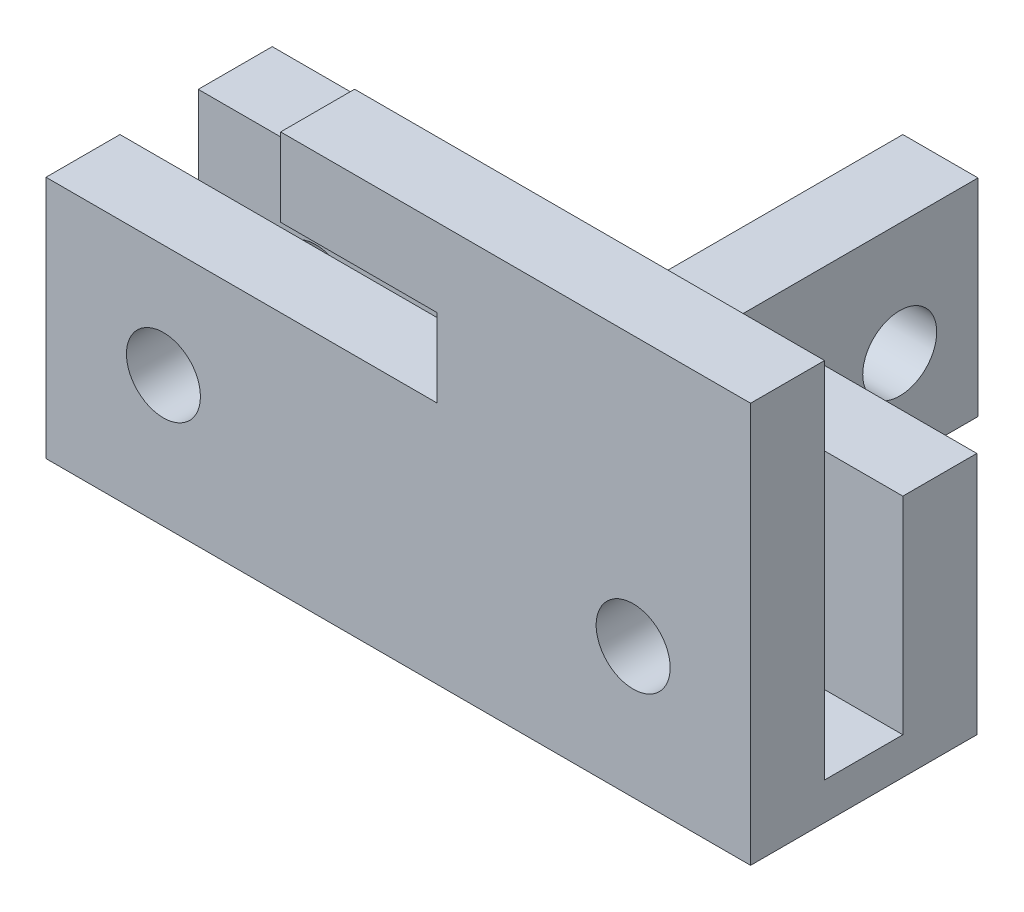
from build123d import *

# Parameters (mm, degrees)
BOSS_EXTRUDE1_DEPTH    = 14.2875
SKETCH4_R              = 1.5
CUT_EXTRUDE1_DEPTH     = 20.646048082
CUT_EXTRUDE3_REACH     = 21.646
SKETCH8_W              = 3.175
SKETCH8_H              = 8.382
SKETCH6_W              = 9.7
SKETCH6_H              = 8.382
SKETCH6_R              = 1.5
BOSS_EXTRUDE4_DEPTH    = 3.048
RIGHT_RAMP_MOUNT_DEPTH = 3


with BuildPart() as part:
    # Sketch2 → Boss-Extrude1 (new, symmetric)
    with BuildSketch(Plane(origin=(0, 0, 0), x_dir=(0, 0, -1), z_dir=(1, 0, 0))):
        Polygon((3, 1.5), (3, 9.882), (0, 9.882), (0, 0), (6.175, 0), (6.175, 1.5), align=None)
        Polygon((6.175, 1.5), (6.175, 0), (9.175, 0), (9.175, 9.882), (6.175, 9.882), align=None)
    extrude(amount=BOSS_EXTRUDE1_DEPTH, both=True)

    # Sketch4 → Cut-Extrude1 (cut, through all)
    with BuildSketch(Plane(origin=(0, 0, 0), x_dir=(-1, 0, 0), z_dir=(0, 0, -1))):
        with Locations(Location((-9.525, 5.31, 0), (0, 0, 180))):
            Circle(SKETCH4_R)
        with Locations(Location((9.525, 5.31, 0), (0, 0, 180))):
            Circle(SKETCH4_R)
    extrude(amount=CUT_EXTRUDE1_DEPTH, mode=Mode.SUBTRACT)

    # Sketch8 → Cut-Extrude3 (cut, up to next)
    with BuildSketch(Plane(origin=(0, 0, -9.175), x_dir=(-1, 0, 0), z_dir=(0, 0, -1)), mode=Mode.PRIVATE) as cut_extrude3_sk1:
        with Locations((0, 5.691)):
            Rectangle(SKETCH8_W, SKETCH8_H)
    cut_extrude3_tool1 = extrude(cut_extrude3_sk1.sketch, amount=-CUT_EXTRUDE3_REACH, mode=Mode.PRIVATE) & part.part
    add(cut_extrude3_tool1.solids().sort_by_distance((0, 5.691, -9.175))[0], mode=Mode.SUBTRACT)

    # Sketch6 → Boss-Extrude4 (add)
    with BuildSketch(Plane(origin=(1.5875, 0, 0), x_dir=(0, 0, -1), z_dir=(1, 0, 0))):
        with Locations((14.025, 5.691)):
            Rectangle(SKETCH6_W, SKETCH6_H)
        with Locations(Location((15.7, 5.31, 0), (0, 0, 180))):
            Circle(SKETCH6_R, mode=Mode.SUBTRACT)
    extrude(amount=BOSS_EXTRUDE4_DEPTH)

    # Sketch9 → Right Ramp Mount (add)
    with BuildSketch(Plane.XY):
        Polygon((1.5785, 9.882), (14.2875, 9.882), (14.2875, 16.232), (-4.7715, 16.232), (-4.7715, 13.057), (1.5785, 13.057), align=None)
    extrude(amount=-RIGHT_RAMP_MOUNT_DEPTH)


solid = part.part
